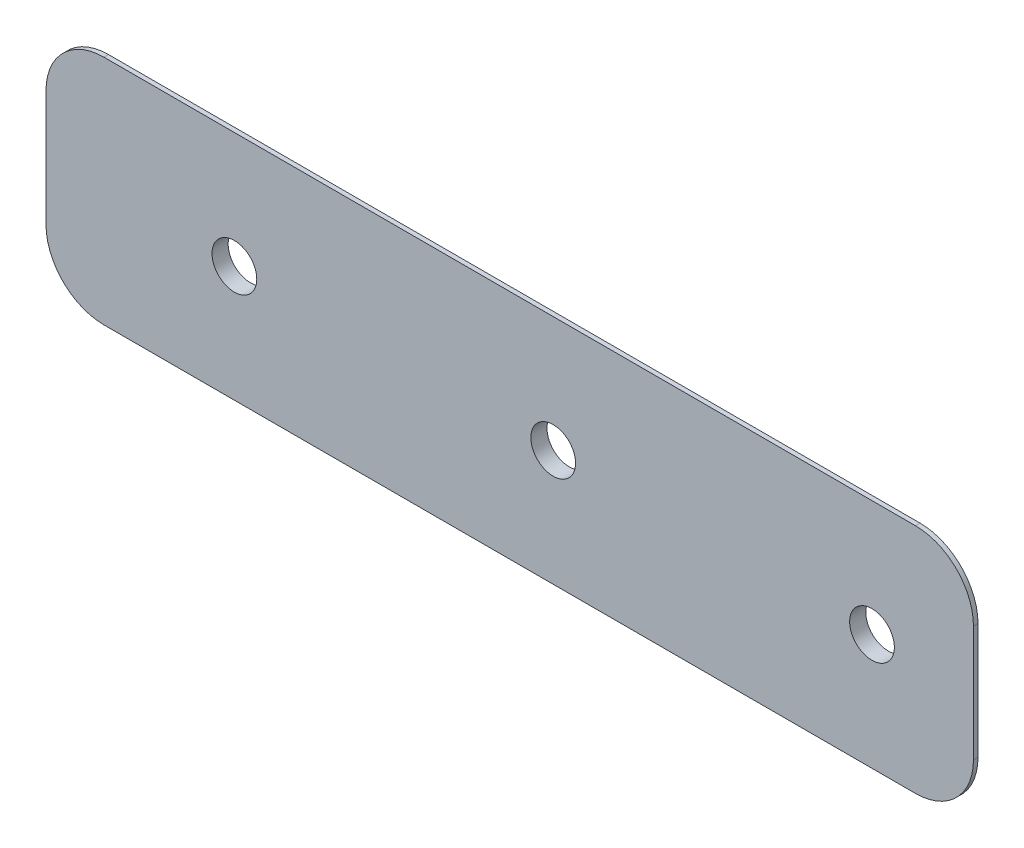
from build123d import *

# Parameters (mm, degrees)
SKETCH1_W                        = 203.2
SKETCH1_H                        = 50.8
BOSS_EXTRUDE1_DEPTH              = 1
SKETCH1_3_R                      = 6.477
BOSS_EXTRUDE2_DEPTH              = 2.54
SKETCH2_W                        = 4.9022
SKETCH2_H                        = 3.54
F_3_8_CLEARANCE_HOLE1_AT_2_COUNT = 2
F_3_8_CLEARANCE_HOLE1_AT_2_PITCH = 69.85
F_3_8_CLEARANCE_HOLE1_AT_3_COUNT = 2
F_3_8_CLEARANCE_HOLE1_AT_3_PITCH = 139.7
F_3_8_CLEARANCE_HOLE1_AT_4_COUNT = 2
F_3_8_CLEARANCE_HOLE1_AT_4_PITCH = 69.85
FILLET1_R                        = 12.7


with BuildPart() as part:
    # Sketch1 → Boss-Extrude1 (new body)
    with BuildSketch(Plane.XY):
        with Locations((-9.525, 0)):
            Rectangle(SKETCH1_W, SKETCH1_H)
    extrude(amount=BOSS_EXTRUDE1_DEPTH)

    # Sketch1<3> → Boss-Extrude2 (add)
    with BuildSketch(Plane.XY):
        with Locations((-69.85, 0)):
            Circle(SKETCH1_3_R)
        Circle(SKETCH1_3_R)
        with Locations((69.85, 0)):
            Circle(SKETCH1_3_R)
    extrude(amount=-BOSS_EXTRUDE2_DEPTH)

    # Sketch2 → 3/8 Clearance Hole1 (revolve, cut)
    with BuildSketch(Plane(origin=(-69.85, 0, 1), x_dir=(0, -1, 0), z_dir=(1, 0, 0))):
        with Locations((2.4511, 1.77)):
            Rectangle(SKETCH2_W, SKETCH2_H)
    f_3_8_clearance_hole1 = revolve(axis=Axis((-69.85, 0, 7.35), (0, 0, -1)), mode=Mode.SUBTRACT)

    # 3/8 Clearance Hole1 at 2: 3/8 Clearance Hole1 ×2
    with Locations(*[(i * F_3_8_CLEARANCE_HOLE1_AT_2_PITCH, 0, 0) for i in range(1, F_3_8_CLEARANCE_HOLE1_AT_2_COUNT)]):
        add(f_3_8_clearance_hole1, mode=Mode.SUBTRACT)

    # 3/8 Clearance Hole1 at 3: 3/8 Clearance Hole1 ×2
    with Locations(*[(i * F_3_8_CLEARANCE_HOLE1_AT_3_PITCH, 0, 0) for i in range(1, F_3_8_CLEARANCE_HOLE1_AT_3_COUNT)]):
        add(f_3_8_clearance_hole1, mode=Mode.SUBTRACT)

    # 3/8 Clearance Hole1 at 4: 3/8 Clearance Hole1 ×2
    with Locations(*[(i * F_3_8_CLEARANCE_HOLE1_AT_4_PITCH, 0, 0) for i in range(1, F_3_8_CLEARANCE_HOLE1_AT_4_COUNT)]):
        add(f_3_8_clearance_hole1, mode=Mode.SUBTRACT)

    # Fillet1
    fillet1_edges = [part.edges().sort_by_distance(p)[0] for p in [
        (-111.125, -25.4, 0.5),
        (-111.125, 25.4, 0.5),
        (92.075, -25.4, 0.5),
        (92.075, 25.4, 0.5),
    ]]
    fillet(fillet1_edges, radius=FILLET1_R)


solid = part.part
